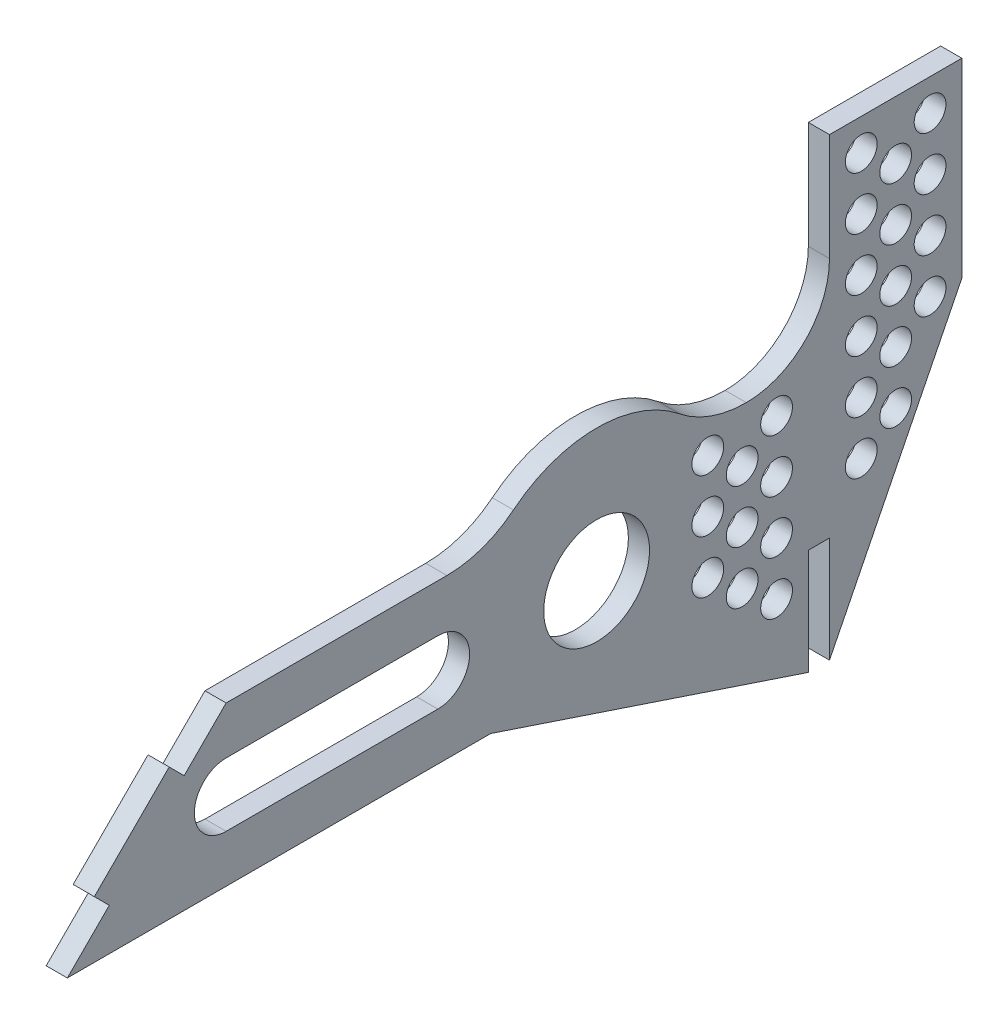
from build123d import *

# Parameters (mm, degrees)
SKETCH2_R           = 10
SKETCH2_R_2         = 3
BOSS_EXTRUDE1_DEPTH = 4


with BuildPart() as part:
    # Sketch2 → Boss-Extrude1 (new body)
    with BuildSketch(Plane(origin=(0, 0, 0), x_dir=(0, 0, -1), z_dir=(1, 0, 0))):
        with BuildLine():
            Line((119, 9), (119, 44.995728753))
            Line((119, 44.995728753), (94, 44.995728753))
            Line((94, 44.995728753), (94, 24.715728753))
            ThreePointArc((94, 24.715728753), (89.39696962, 13.60303038), (78.284271247, 9))
            ThreePointArc((78.284271247, 9), (71.617604581, 10.143819168), (65.713484026, 13.444444444))
            ThreePointArc((65.713484026, 13.444444444), (50, 19), (34.286515974, 13.444444444))
            ThreePointArc((34.286515974, 13.444444444), (28.382395419, 10.143819168), (21.715728753, 9))
            Line((21.715728753, 9), (-20, 9))
            Line((-20, 9), (-27.928932188, 1.071067812))
            Line((-27.928932188, 1.071067812), (-30.757359313, 3.899494937))
            Line((-30.757359313, 3.899494937), (-44.899494937, -10.242640687))
            Line((-44.899494937, -10.242640687), (-42.071067812, -13.071067812))
            Line((-42.071067812, -13.071067812), (-50, -21))
            Line((-50, -21), (18.196601125, -21))
            Line((18.196601125, -21), (30, -21))
            Line((30, -21), (90, -41))
            Line((90, -41), (90, -21))
            Line((90, -21), (94, -21))
            Line((94, -21), (94, -41))
            Line((94, -41), (119, 9))
        make_face()
        with Locations((50, -6)):
            Circle(SKETCH2_R, mode=Mode.SUBTRACT)
        with Locations((106.5, -6)):
            Circle(SKETCH2_R_2, mode=Mode.SUBTRACT)
        with Locations((106.5, 4)):
            Circle(SKETCH2_R_2, mode=Mode.SUBTRACT)
        with Locations((113, 9)):
            Circle(SKETCH2_R_2, mode=Mode.SUBTRACT)
        with Locations((106.5, 14)):
            Circle(SKETCH2_R_2, mode=Mode.SUBTRACT)
        with Locations((113, 19)):
            Circle(SKETCH2_R_2, mode=Mode.SUBTRACT)
        with Locations((106.5, 24)):
            Circle(SKETCH2_R_2, mode=Mode.SUBTRACT)
        with Locations((113, 29)):
            Circle(SKETCH2_R_2, mode=Mode.SUBTRACT)
        with Locations((113, 39)):
            Circle(SKETCH2_R_2, mode=Mode.SUBTRACT)
        with Locations((106.5, 34)):
            Circle(SKETCH2_R_2, mode=Mode.SUBTRACT)
        with Locations((100, 39)):
            Circle(SKETCH2_R_2, mode=Mode.SUBTRACT)
        with Locations((100, 29)):
            Circle(SKETCH2_R_2, mode=Mode.SUBTRACT)
        with Locations((100, 19)):
            Circle(SKETCH2_R_2, mode=Mode.SUBTRACT)
        with Locations((100, 9)):
            Circle(SKETCH2_R_2, mode=Mode.SUBTRACT)
        with Locations((100, -1)):
            Circle(SKETCH2_R_2, mode=Mode.SUBTRACT)
        with Locations((100, -11)):
            Circle(SKETCH2_R_2, mode=Mode.SUBTRACT)
        with Locations((84, 4)):
            Circle(SKETCH2_R_2, mode=Mode.SUBTRACT)
        with Locations((71, 4)):
            Circle(SKETCH2_R_2, mode=Mode.SUBTRACT)
        with Locations((77.5, -1)):
            Circle(SKETCH2_R_2, mode=Mode.SUBTRACT)
        with Locations((84, -6)):
            Circle(SKETCH2_R_2, mode=Mode.SUBTRACT)
        with Locations((84, -16)):
            Circle(SKETCH2_R_2, mode=Mode.SUBTRACT)
        with Locations((77.5, -11)):
            Circle(SKETCH2_R_2, mode=Mode.SUBTRACT)
        with Locations((71, -6)):
            Circle(SKETCH2_R_2, mode=Mode.SUBTRACT)
        with Locations((71, -16)):
            Circle(SKETCH2_R_2, mode=Mode.SUBTRACT)
        with Locations((84, -26)):
            Circle(SKETCH2_R_2, mode=Mode.SUBTRACT)
        with Locations((77.5, -21)):
            Circle(SKETCH2_R_2, mode=Mode.SUBTRACT)
        with BuildLine():
            Line((20, 0), (-20, 0))
            ThreePointArc((-20, 0), (-26, -6), (-20, -12))
            Line((-20, -12), (20, -12))
            ThreePointArc((20, -12), (26, -6), (20, 0))
        make_face(mode=Mode.SUBTRACT)
    extrude(amount=BOSS_EXTRUDE1_DEPTH)


solid = part.part
